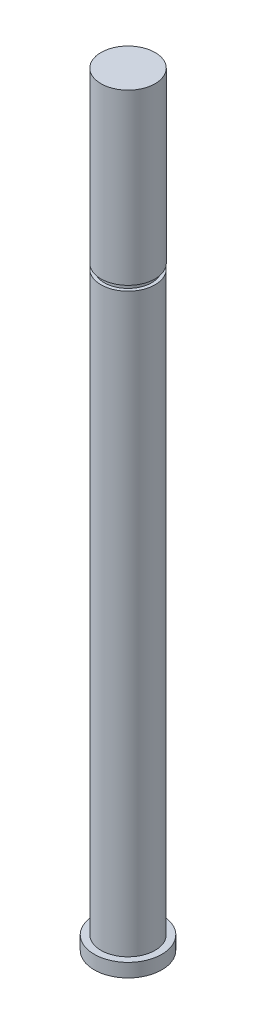
from build123d import *

# Parameters (mm, degrees)
SKETCH1_R           = 4
BOSS_EXTRUDE1_DEPTH = 113
CUT_EXTRUDE1_START  = -0.75
SKETCH2_R           = 4
SKETCH2_R_2         = 3.5
CUT_EXTRUDE1_DEPTH  = 0.75
SKETCH3_R           = 5
BOSS_EXTRUDE2_DEPTH = 2


with BuildPart() as part:
    # Sketch1 → Boss-Extrude1 (new body)
    with BuildSketch(Plane(origin=(0, 0, 0), x_dir=(1, 0, 0), z_dir=(0, 1, 0))):
        with Locations(Location((0, 0, 0), (0, 0, 270))):
            Circle(SKETCH1_R)
    extrude(amount=BOSS_EXTRUDE1_DEPTH)

    # Sketch2 → Cut-Extrude1 (cut)
    with BuildSketch(Plane(origin=(0, 88, 0), x_dir=(1, 0, 0), z_dir=(0, 1, 0)).offset(CUT_EXTRUDE1_START)):
        with Locations(Location((0, 0, 0), (0, 0, 270))):
            Circle(SKETCH2_R)
        with Locations(Location((0, 0, 0), (0, 0, 270))):
            Circle(SKETCH2_R_2, mode=Mode.SUBTRACT)
    extrude(amount=CUT_EXTRUDE1_DEPTH, mode=Mode.SUBTRACT)

    # Sketch3 → Boss-Extrude2 (add)
    with BuildSketch(Plane(origin=(0, 0, 0), x_dir=(-1, 0, 0), z_dir=(0, -1, 0))):
        with Locations(Location((0, 0, 0), (0, 0, 90))):
            Circle(SKETCH3_R)
    extrude(amount=-BOSS_EXTRUDE2_DEPTH)


solid = part.part
